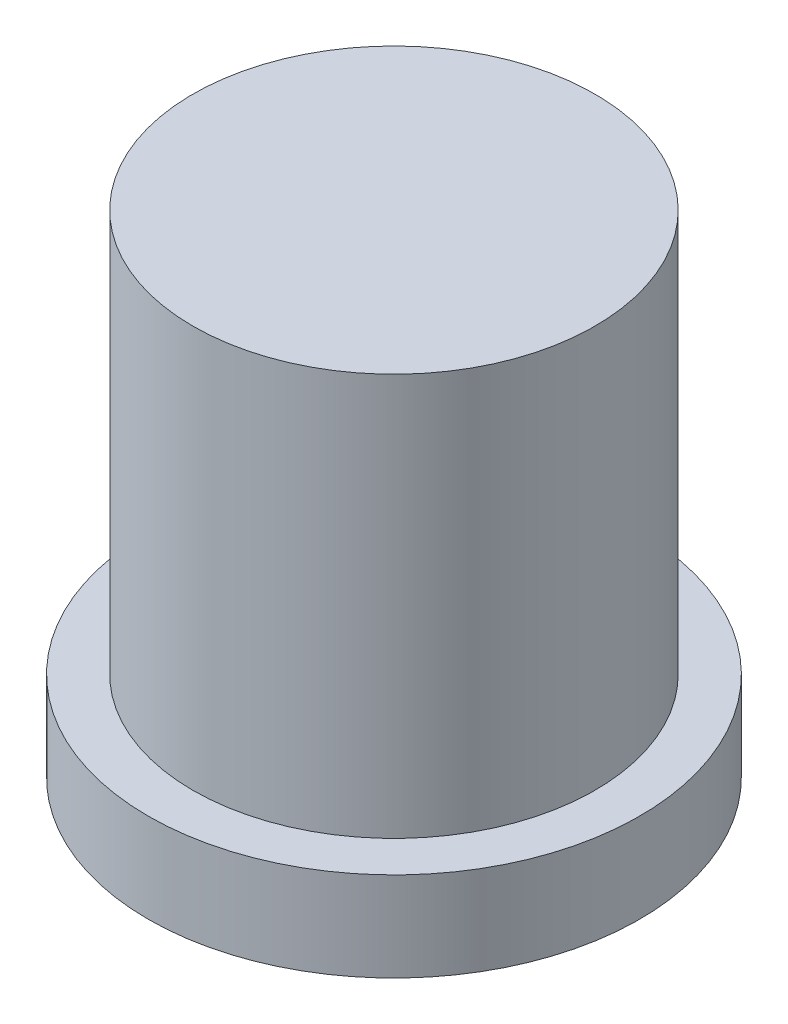
from build123d import *

# Parameters (mm, degrees)
SKETCH1_R           = 34.925
BOSS_EXTRUDE1_DEPTH = 12.7
SKETCH2_R           = 28.575
BOSS_EXTRUDE2_DEPTH = 57.15


with BuildPart() as part:
    # Sketch1 → Boss-Extrude1 (new body)
    with BuildSketch(Plane(origin=(0, 0, 0), x_dir=(1, 0, 0), z_dir=(0, 1, 0))):
        with Locations(Location((0, 0, 0), (0, 0, 270))):
            Circle(SKETCH1_R)
    extrude(amount=BOSS_EXTRUDE1_DEPTH)

    # Sketch2 → Boss-Extrude2 (add)
    with BuildSketch(Plane(origin=(0, 12.7, 0), x_dir=(1, 0, 0), z_dir=(0, 1, 0))):
        with Locations(Location((0, 0, 0), (0, 0, 270))):
            Circle(SKETCH2_R)
    extrude(amount=BOSS_EXTRUDE2_DEPTH)


solid = part.part
